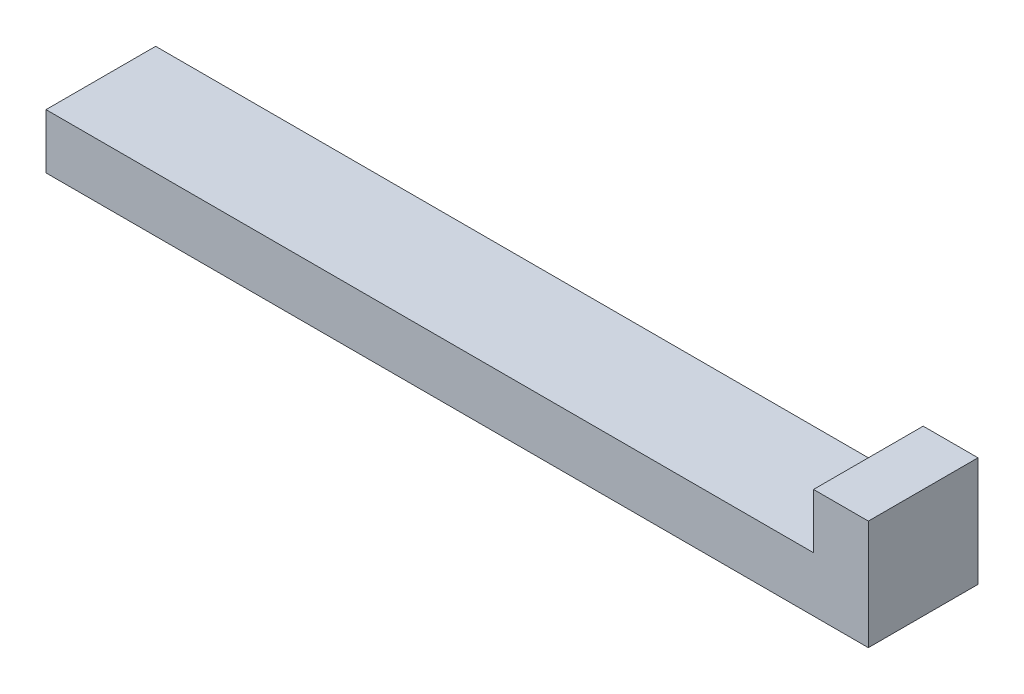
from build123d import *

# Parameters (mm, degrees)
EXTRUDE_1_DEPTH = 2


with BuildPart() as part:
    # 草图1 → 凸台-拉伸1 (new body)
    with BuildSketch(Plane.XY):
        Polygon((0, 0), (15, 0), (15, 2), (14, 2), (14, 1), (0, 1), align=None)
    extrude(amount=EXTRUDE_1_DEPTH)


solid = part.part
